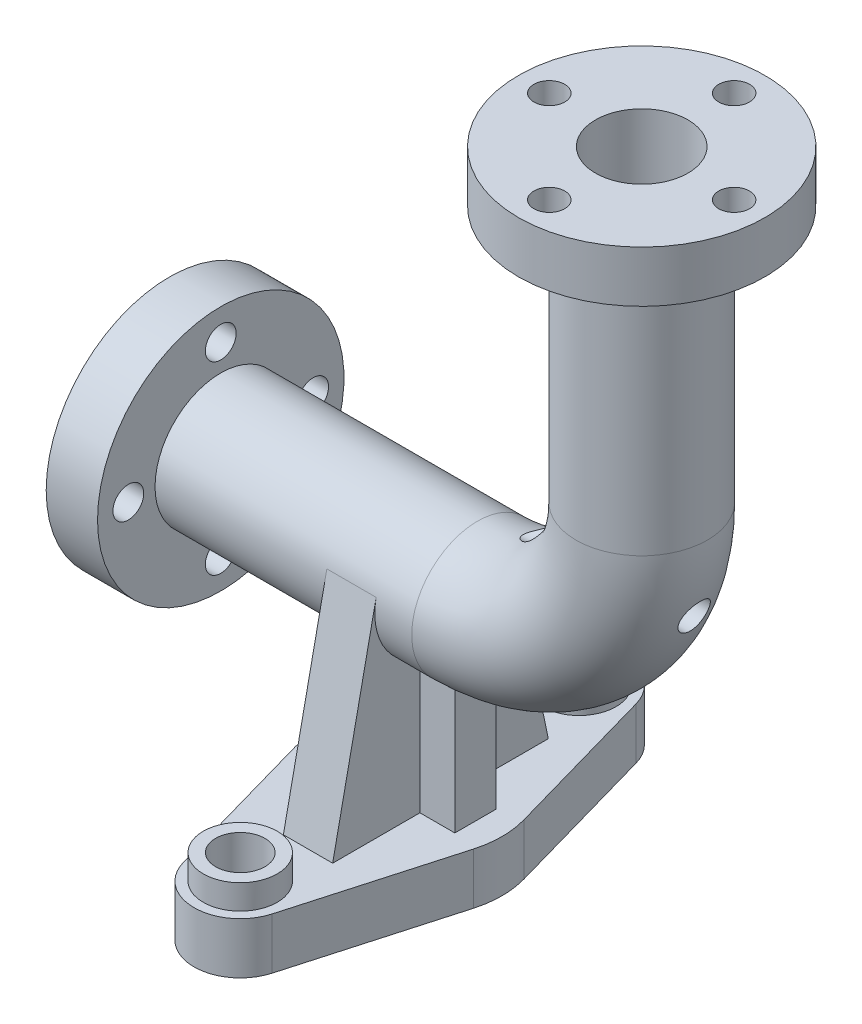
from build123d import *

# Parameters (mm, degrees)
SKETCH2_R           = 32
SKETCH2_R_2         = 22.5
SKETCH3_R           = 60
SKETCH3_R_2         = 22.5
BOSS_EXTRUDE1_DEPTH = 25
BOSS_EXTRUDE2_START = -25
SKETCH4_R           = 60
SKETCH4_R_2         = 22.5
BOSS_EXTRUDE2_DEPTH = 25
HOLE1_D             = 15
CIRPATTERN1_COUNT   = 4
HOLE2_D             = 15
CIRPATTERN2_COUNT   = 4
BOSS_EXTRUDE3_DEPTH = 25
SKETCH10_R          = 18
BOSS_EXTRUDE4_DEPTH = 12
SKETCH12_W          = 12
SKETCH12_H          = 37
HOLE3_AT_2_COUNT    = 2
HOLE3_AT_2_PITCH    = 165
SKETCH13_W          = 64
SKETCH13_H          = 89
BOSS_EXTRUDE5_DEPTH = 10
BOSS_EXTRUDE6_DEPTH = 12


with BuildPart() as part:
    # Sweep1: sweep along a path in Sketch1
    with BuildLine(Plane.XY) as sweep1_path:
        Line((0, 0), (150, 0))
        ThreePointArc((150, 0), (206.568542495, 23.431457505), (230, 80))
        Line((230, 80), (230, 230))
    # Sketch2 → Sweep1 (sweep)
    with BuildSketch(Plane(origin=(0, 0, 0), x_dir=(0, 0, -1), z_dir=(1, 0, 0))):
        Circle(SKETCH2_R)
        Circle(SKETCH2_R_2, mode=Mode.SUBTRACT)
    sweep(path=sweep1_path.line)

    # Sketch3 → Boss-Extrude1 (add)
    with BuildSketch(Plane(origin=(0, 230, 0), x_dir=(1, 0, 0), z_dir=(0, 1, 0))):
        with Locations(Location((230, 0, 0), (0, 0, 270))):
            Circle(SKETCH3_R)
        with Locations((230, 0)):
            Circle(SKETCH3_R_2, mode=Mode.SUBTRACT)
    extrude(amount=-BOSS_EXTRUDE1_DEPTH)

    # Sketch4 → Boss-Extrude2 (add)
    with BuildSketch(Plane.ZY.offset(BOSS_EXTRUDE2_START)):
        Circle(SKETCH4_R)
        with Locations(Location((0, 0, 0), (0, 0, 180))):
            Circle(SKETCH4_R_2, mode=Mode.SUBTRACT)
    extrude(amount=BOSS_EXTRUDE2_DEPTH)

    # Hole1 (through all)
    with Locations(Plane(origin=(0, 230, 0), x_dir=(1, 0, 0), z_dir=(0, 1, 0))):
        with Locations((275, 0)):
            hole1 = Hole(HOLE1_D / 2)

    # CirPattern1: Hole1 ×4 about axis
    cirpattern1_axis = Axis((230, 0, 0), (0, 1, 0))
    for i in range(1, CIRPATTERN1_COUNT):
        add(hole1.rotate(cirpattern1_axis, i * 360 / CIRPATTERN1_COUNT), mode=Mode.SUBTRACT)

    # Hole2 (through all)
    with Locations(Plane.ZY):
        with Locations((45, 0)):
            hole2 = Hole(HOLE2_D / 2)

    # CirPattern2: Hole2 ×4 about axis
    cirpattern2_axis = Axis((0, 0, 0), (1, 0, 0))
    for i in range(1, CIRPATTERN2_COUNT):
        add(hole2.rotate(cirpattern2_axis, i * 360 / CIRPATTERN2_COUNT), mode=Mode.SUBTRACT)



with BuildPart() as body_2:
    # Sketch9 → Boss-Extrude3 (new body)
    with BuildSketch(Plane(origin=(0, -120, 0), x_dir=(1, 0, 0), z_dir=(0, 1, 0))):
        with BuildLine():
            Line((95.352943819, 88.636363636), (73.705887637, 12.272727273))
            ThreePointArc((73.705887637, 12.272727273), (72, 0), (73.705887637, -12.272727273))
            Line((73.705887637, -12.272727273), (95.352943819, -88.636363636))
            ThreePointArc((95.352943819, -88.636363636), (117, -105), (138.647056181, -88.636363636))
            Line((138.647056181, -88.636363636), (160.294112363, -12.272727273))
            ThreePointArc((160.294112363, -12.272727273), (162, 0), (160.294112363, 12.272727273))
            Line((160.294112363, 12.272727273), (138.647056181, 88.636363636))
            ThreePointArc((138.647056181, 88.636363636), (117, 105), (95.352943819, 88.636363636))
        make_face()
    extrude(amount=BOSS_EXTRUDE3_DEPTH)

    # Sketch10 → Boss-Extrude4 (add)
    with BuildSketch(Plane(origin=(0, -95, 0), x_dir=(1, 0, 0), z_dir=(0, 1, 0))):
        with Locations(Location((117, -82.5, 0), (0, 0, 90))):
            Circle(SKETCH10_R)
        with Locations(Location((117, 82.5, 0), (0, 0, 90))):
            Circle(SKETCH10_R)
    extrude(amount=BOSS_EXTRUDE4_DEPTH)

    # Sketch12 → Hole3 (revolve, cut)
    with BuildSketch(Plane(origin=(117, -83, 82.5), x_dir=(0, 0, 1), z_dir=(1, 0, 0))):
        with Locations((6, 18.5)):
            Rectangle(SKETCH12_W, SKETCH12_H)
    hole3 = revolve(axis=Axis((117, -193, 82.5), (0, 1, 0)), mode=Mode.SUBTRACT)

    # Hole3 at 2: Hole3 ×2
    with Locations(*[(0, 0, -i * HOLE3_AT_2_PITCH) for i in range(1, HOLE3_AT_2_COUNT)]):
        add(hole3, mode=Mode.SUBTRACT)


with BuildPart() as part_1:
    add(part.part)

    add(body_2.part)  # Boss-Extrude5 merges body 2
    # Sketch13 → Boss-Extrude5 (add, symmetric)
    with BuildSketch(Plane.XY):
        with Locations((117, -75.5)):
            Rectangle(SKETCH13_W, SKETCH13_H)
    extrude(amount=BOSS_EXTRUDE5_DEPTH, both=True)

    # Sketch14 → Boss-Extrude6 (add, symmetric)
    with BuildSketch(Plane(origin=(120, 0, 0), x_dir=(0, 0, -1), z_dir=(1, 0, 0))):
        with BuildLine():
            Line((-31.326062767, 6.532824161), (-52.5, -95))
            Line((-52.5, -95), (52.5, -95))
            Line((52.5, -95), (31.326062767, 6.532824161))
            ThreePointArc((31.326062767, 6.532824161), (0, -32), (-31.326062767, 6.532824161))
        make_face()
    extrude(amount=BOSS_EXTRUDE6_DEPTH, both=True)


solid = part_1.part
